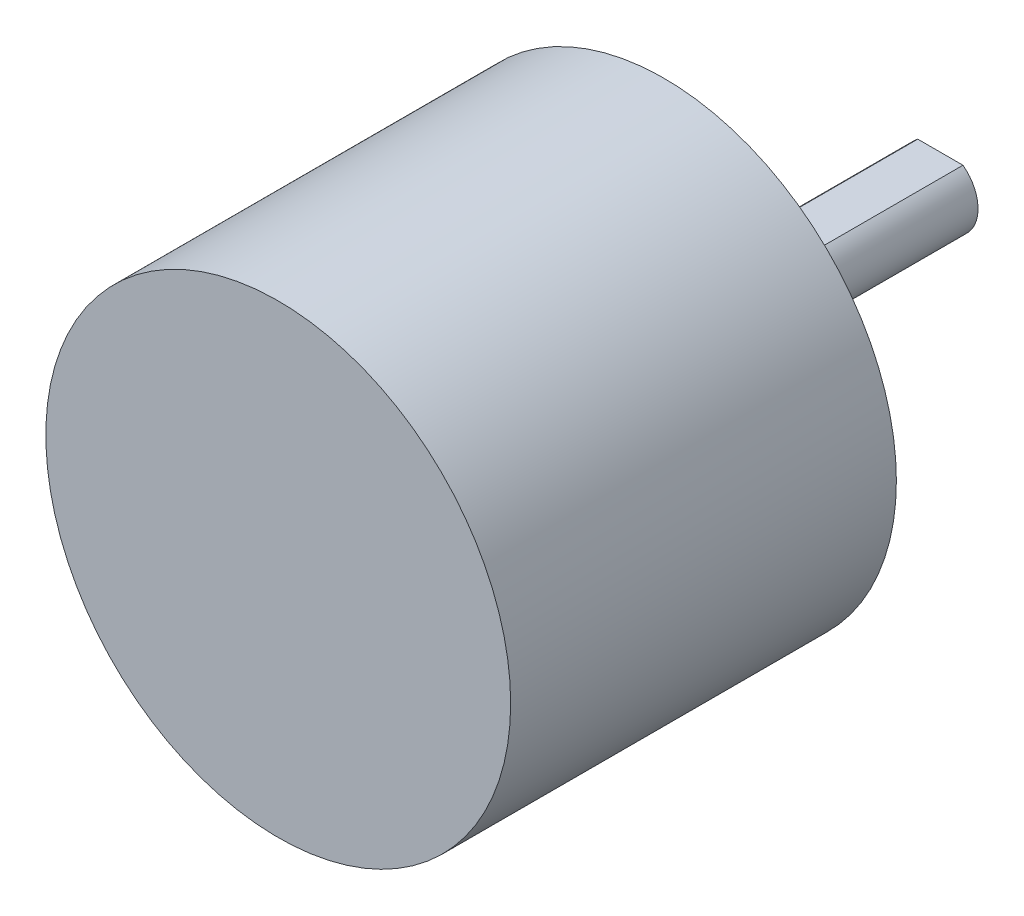
from build123d import *

# Parameters (mm, degrees)
ESQUISSE1_R                  = 18.5
BOSS_EXTRU_1_DEPTH           = 30.7
ESQUISSE2_R                  = 5
BOSS_EXTRU_2_DEPTH           = 6
ESQUISSE3_R                  = 3
BOSS_EXTRU_3_DEPTH           = 16
ENL_V_MAT_EXTRU_2_DEPTH      = 59.836978168
ENL_V_MAT_EXTRU_2_DEPTH_BACK = 16


with BuildPart() as part:
    # Esquisse1 → Boss.-Extru.1 (new body)
    with BuildSketch(Plane.XY):
        Circle(ESQUISSE1_R)
    extrude(amount=BOSS_EXTRU_1_DEPTH)

    # Esquisse2 → Boss.-Extru.2 (add)
    with BuildSketch(Plane(origin=(0, 0, 0), x_dir=(-1, 0, 0), z_dir=(0, 0, -1))):
        Circle(ESQUISSE2_R)
    extrude(amount=BOSS_EXTRU_2_DEPTH)

    # Esquisse3 → Boss.-Extru.3 (add)
    with BuildSketch(Plane(origin=(0, 0, -6), x_dir=(-1, 0, 0), z_dir=(0, 0, -1))):
        Circle(ESQUISSE3_R)
    extrude(amount=BOSS_EXTRU_3_DEPTH)

    # Esquisse4 → Enlèv. mat.-Extru.2 (cut, two sides: drawn at the far end of the back side and taken through both)
    with BuildSketch(Plane(origin=(0, 0, -22), x_dir=(-1, 0, 0), z_dir=(0, 0, -1)).offset(-ENL_V_MAT_EXTRU_2_DEPTH_BACK)):
        Polygon((-70.071777045, 2.4), (-1.8, 2.4), (1.8, 2.4), (70.071777045, 2.4), (70.071777045, 138.94355409), (-70.071777045, 138.94355409), align=None)
    extrude(amount=ENL_V_MAT_EXTRU_2_DEPTH + ENL_V_MAT_EXTRU_2_DEPTH_BACK, mode=Mode.SUBTRACT)


solid = part.part
